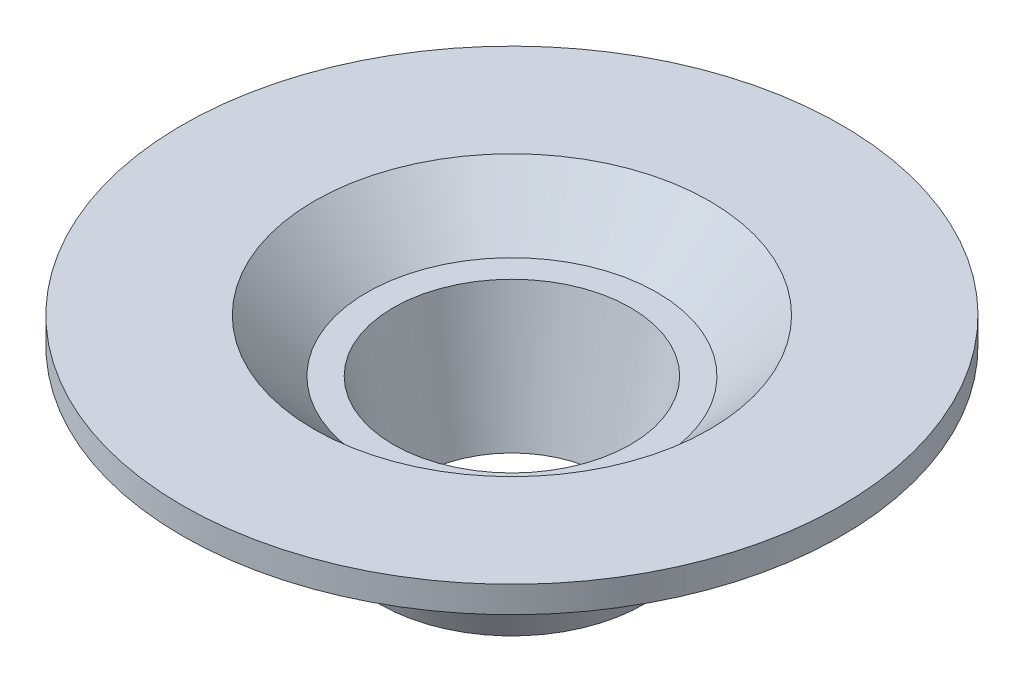
from build123d import *


with BuildPart() as part:
    # Sketch1 → Revolve1 (revolve)
    with BuildSketch(Plane(origin=(0, 0, 0), x_dir=(0, 0, -1), z_dir=(1, 0, 0)), mode=Mode.PRIVATE) as revolve1_sk:
        Polygon((4.5, 0), (3.5, -5), (5, -5), (6.5, -1), (8.5, -1), (10.5, 1), (12.5, 1), (12.5, 2), (7.5, 2), (5.5, 0), align=None)
    revolve(revolve1_sk.sketch.rotate(Axis((0, 0, 0), (0, -1, 0)), 180), axis=Axis((0, 0, 0), (0, -1, 0)))


solid = part.part
